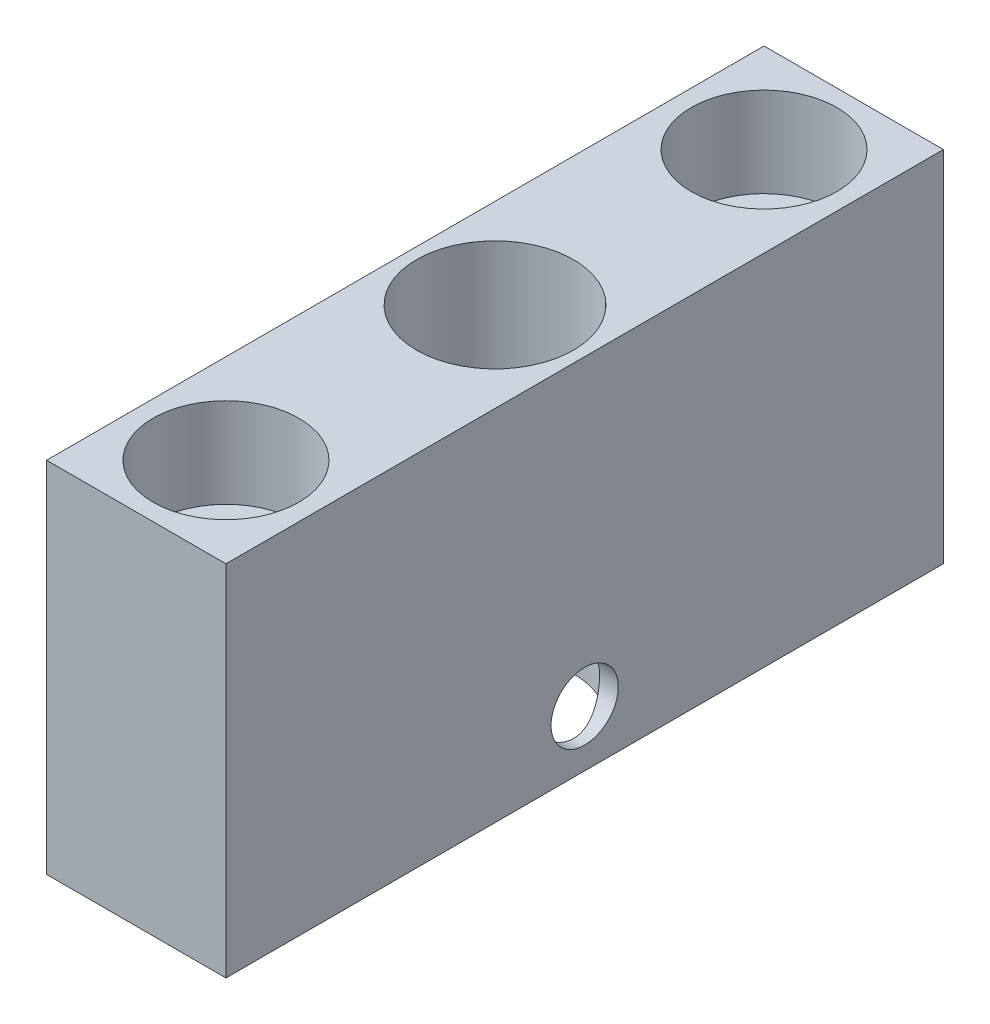
from build123d import *

# Parameters (mm, degrees)
SKETCH1_W                                        = 101.6
SKETCH1_H                                        = 50.8
BOSS_EXTRUDE1_DEPTH                              = 25.4
SKETCH2_R                                        = 11.1125
CUT_EXTRUDE1_DEPTH                               = 50.8
CBORE_FOR_1_2_SOCKET_HEAD_CAP_SCREW1_D           = 13.49248
CBORE_FOR_1_2_SOCKET_HEAD_CAP_SCREW1_DEPTH       = 50.8
CBORE_FOR_1_2_SOCKET_HEAD_CAP_SCREW1_CBORE_D     = 20.6375
CBORE_FOR_1_2_SOCKET_HEAD_CAP_SCREW1_CBORE_DEPTH = 12.7
CBORE_FOR_1_2_SOCKET_HEAD_CAP_SCREW1_TIP         = 4.053549943
SKETCH8_R                                        = 4.7625
CUT_EXTRUDE2_DEPTH                               = 117.397422652


with BuildPart() as part:
    # Sketch1 → Boss-Extrude1 (new body)
    with BuildSketch(Plane(origin=(0, 0, 0), x_dir=(0, 0, -1), z_dir=(1, 0, 0))):
        with Locations((50.8, 25.4)):
            Rectangle(SKETCH1_W, SKETCH1_H)
    extrude(amount=BOSS_EXTRUDE1_DEPTH)

    # Sketch2 → Cut-Extrude1 (cut)
    with BuildSketch(Plane(origin=(0, 50.8, 0), x_dir=(1, 0, 0), z_dir=(0, 1, 0))):
        with Locations(Location((12.7, 50.8, 0), (0, 0, 270))):
            Circle(SKETCH2_R)
    extrude(amount=-CUT_EXTRUDE1_DEPTH, mode=Mode.SUBTRACT)

    # CBORE for 1/2 Socket Head Cap Screw1
    with Locations(Plane(origin=(0, 50.8, 0), x_dir=(1, 0, 0), z_dir=(0, 1, 0))):
        with Locations((12.7, 88.9), (12.7, 12.7)):
            CounterBoreHole(CBORE_FOR_1_2_SOCKET_HEAD_CAP_SCREW1_D / 2, CBORE_FOR_1_2_SOCKET_HEAD_CAP_SCREW1_CBORE_D / 2, CBORE_FOR_1_2_SOCKET_HEAD_CAP_SCREW1_CBORE_DEPTH, depth=CBORE_FOR_1_2_SOCKET_HEAD_CAP_SCREW1_DEPTH)
            with Locations((0, 0, -(CBORE_FOR_1_2_SOCKET_HEAD_CAP_SCREW1_DEPTH + CBORE_FOR_1_2_SOCKET_HEAD_CAP_SCREW1_TIP / 2))):  # 118° drill point
                Cone(0, CBORE_FOR_1_2_SOCKET_HEAD_CAP_SCREW1_D / 2, CBORE_FOR_1_2_SOCKET_HEAD_CAP_SCREW1_TIP, mode=Mode.SUBTRACT)

    # Sketch8 → Cut-Extrude2 (cut, through all)
    with BuildSketch(Plane.ZY):
        with Locations((-50.8, 7.9375)):
            Circle(SKETCH8_R)
    extrude(amount=-CUT_EXTRUDE2_DEPTH, mode=Mode.SUBTRACT)


solid = part.part
